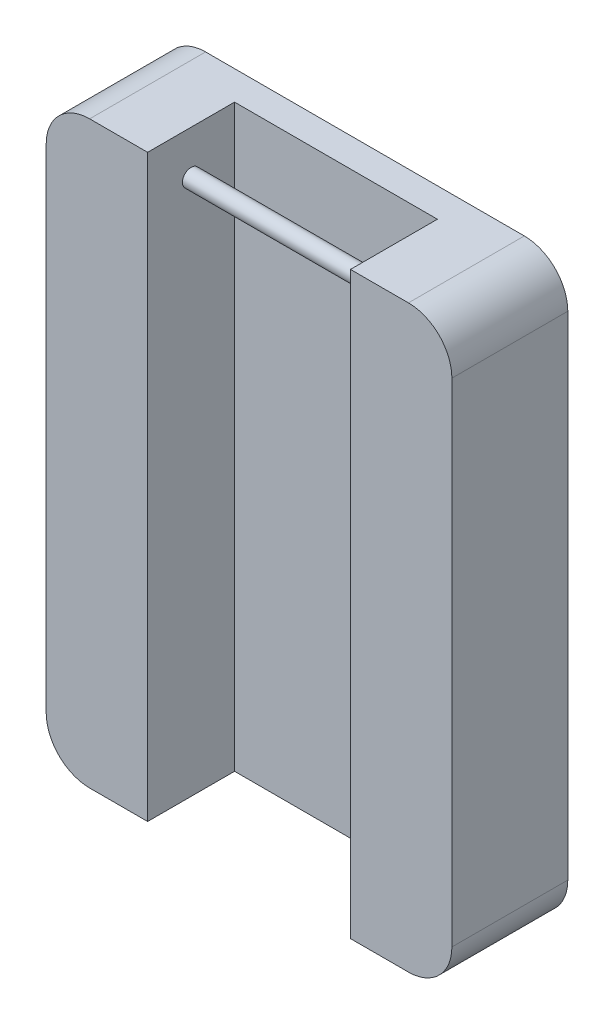
from build123d import *

# Parameters (mm, degrees)
EXTRUDE_1_DEPTH     = 40
CUT_EXTRUDE_1_DEPTH = 30
SKETCH_4_R          = 3
EXTRUDE_2_DEPTH     = 83.650089496


with BuildPart() as part:
    # 草图2 → 凸台-拉伸1 (new body)
    with BuildSketch(Plane.XY):
        with BuildLine():
            Line((0, 100), (-55, 100))
            ThreePointArc((-55, 100), (-65.606601718, 95.606601718), (-70, 85))
            Line((-70, 85), (-70, -85))
            ThreePointArc((-70, -85), (-65.606601718, -95.606601718), (-55, -100))
            Line((-55, -100), (55, -100))
            ThreePointArc((55, -100), (65.606601718, -95.606601718), (70, -85))
            Line((70, -85), (70, 85))
            ThreePointArc((70, 85), (65.606601718, 95.606601718), (55, 100))
            Line((55, 100), (0, 100))
        make_face()
    extrude(amount=EXTRUDE_1_DEPTH)

    # 草图3 → 切除-拉伸1 (cut)
    with BuildSketch(Plane.XY.offset(40)):
        Polygon((0, 100), (-35, 100), (-35, -100), (35, -100), (35, 100), align=None)
    extrude(amount=-CUT_EXTRUDE_1_DEPTH, mode=Mode.SUBTRACT)

    # 草图4 → 凸台-拉伸2 (add)
    with BuildSketch(Plane(origin=(-35, 0, 0), x_dir=(0, 0, -1), z_dir=(1, 0, 0))):
        with Locations(Location((-25, 85, 0), (0, 0, 180))):
            Circle(SKETCH_4_R)
    extrude(amount=EXTRUDE_2_DEPTH)


solid = part.part
